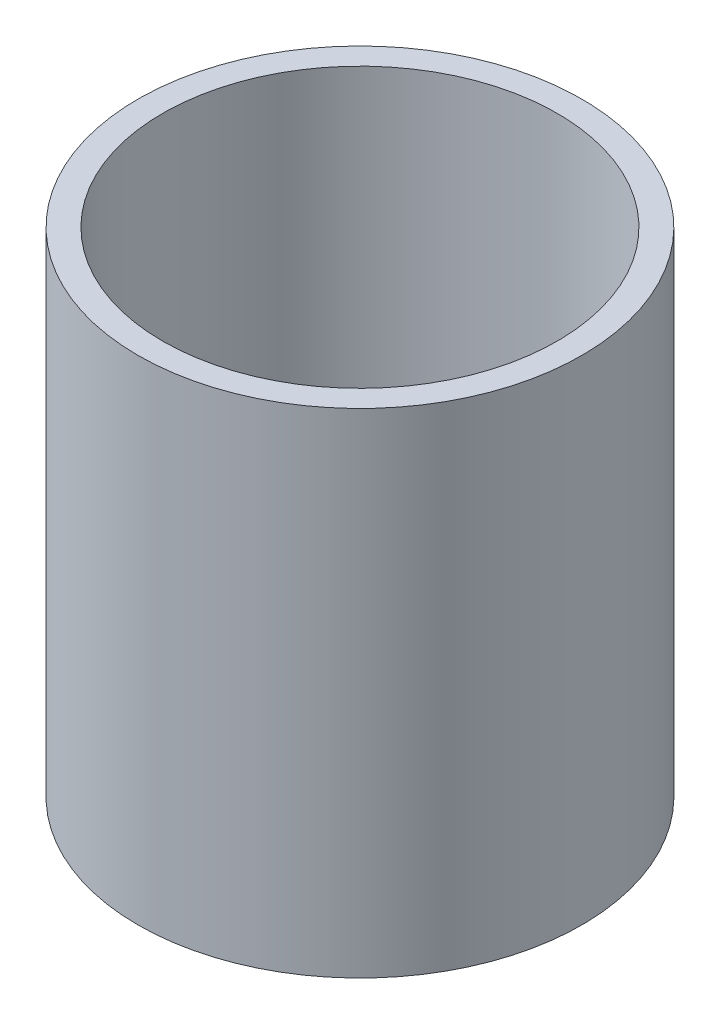
from build123d import *

# Parameters (mm, degrees)
SKETCH1_R           = 9
BOSS_EXTRUDE1_DEPTH = 20
SKETCH2_R           = 8
CUT_EXTRUDE1_DEPTH  = 24.706539182


with BuildPart() as part:
    # Sketch1 → Boss-Extrude1 (new body)
    with BuildSketch(Plane(origin=(0, 0, 0), x_dir=(1, 0, 0), z_dir=(0, 1, 0))):
        with Locations(Location((0, 0, 0), (0, 0, 270))):
            Circle(SKETCH1_R)
    extrude(amount=BOSS_EXTRUDE1_DEPTH)

    # Sketch2 → Cut-Extrude1 (cut, through all)
    with BuildSketch(Plane(origin=(0, 20, 0), x_dir=(1, 0, 0), z_dir=(0, 1, 0))):
        with Locations(Location((0, 0, 0), (0, 0, 270))):
            Circle(SKETCH2_R)
    extrude(amount=-CUT_EXTRUDE1_DEPTH, mode=Mode.SUBTRACT)


solid = part.part
